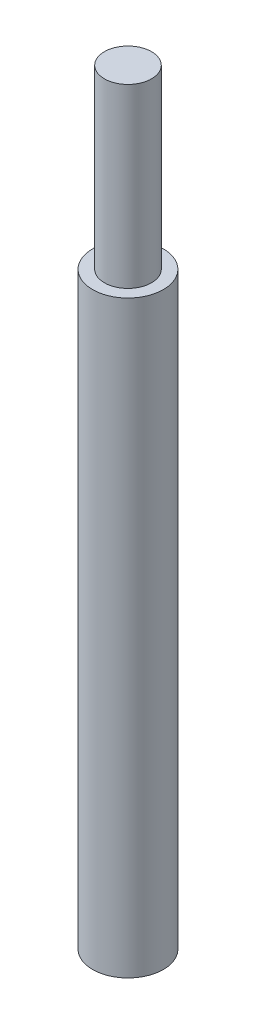
from build123d import *

# Parameters (mm, degrees)
SKETCH1_R        = 3
STEEL_TUBE_DEPTH = 50
CABLE_STUB_START = 50
SKETCH2_R        = 2
CABLE_STUB_DEPTH = 15


with BuildPart() as part:
    # Sketch1 → Steel_Tube (new body)
    with BuildSketch(Plane(origin=(0, 0, 0), x_dir=(1, 0, 0), z_dir=(0, 1, 0))):
        with Locations(Location((0, 0, 0), (0, 0, 270))):
            Circle(SKETCH1_R)
    extrude(amount=STEEL_TUBE_DEPTH)

    # Sketch2 → Cable_Stub (add)
    with BuildSketch(Plane(origin=(0, 0, 0), x_dir=(1, 0, 0), z_dir=(0, 1, 0)).offset(CABLE_STUB_START)):
        with Locations(Location((0, 0, 0), (0, 0, 270))):
            Circle(SKETCH2_R)
    extrude(amount=CABLE_STUB_DEPTH)


solid = part.part
